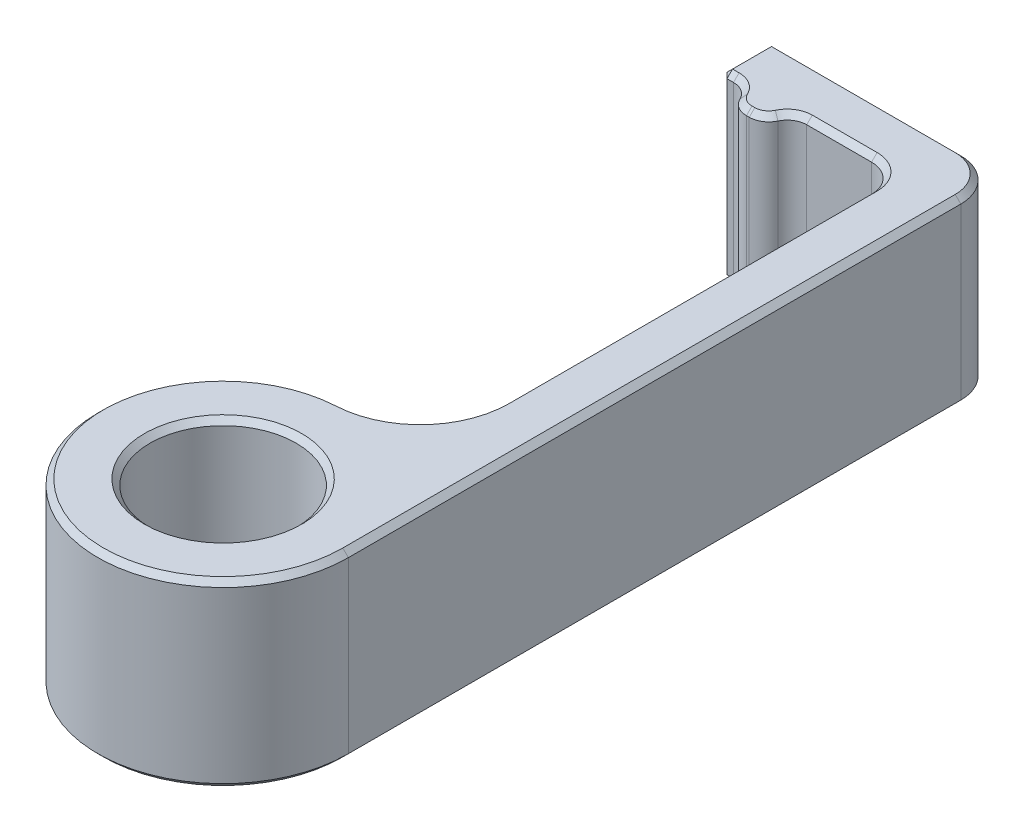
from build123d import *

# Parameters (mm, degrees)
SKETCH_1_R      = 5.25
EXTRUDE_1_DEPTH = 13
FILLET_1_R      = 6
FILLET_2_R      = 2
FILLET_3_R      = 3
SKETCH_2_W      = 3
SKETCH_2_H      = 13
EXTRUDE_2_DEPTH = 1.6
FILLET_4_R      = 1.4
FILLET_5_R      = 1.4
CHAMFER_1_SIZE  = 0.4


with BuildPart() as part:
    # 草图1 → 凸台-拉伸1 (new body)
    with BuildSketch(Plane(origin=(0, 0, 0), x_dir=(1, 0, 0), z_dir=(0, 1, 0))):
        with BuildLine():
            Line((5.188235294, 7.354061091), (5.188235294, 43.4))
            Line((5.188235294, 43.4), (-7.6, 43.4))
            Line((-7.6, 43.4), (-7.6, 47))
            Line((-7.6, 47), (5.4, 47))
            Line((5.4, 47), (9, 47))
            Line((9, 47), (9, 0))
            ThreePointArc((9, 0), (-7.990435459, -4.14161094), (5.188235294, 7.354061091))
        make_face()
        with Locations(Location((0, 0, 0), (0, 0, 90))):
            Circle(SKETCH_1_R, mode=Mode.SUBTRACT)
    extrude(amount=EXTRUDE_1_DEPTH)

    # 圆角1
    fillet_1_edges = [part.edges().sort_by_distance(p)[0] for p in [
        (5.188235294, 6.5, -7.354061091),
    ]]
    fillet(fillet_1_edges, radius=FILLET_1_R)

    # 圆角2
    fillet_2_edges = [part.edges().sort_by_distance(p)[0] for p in [
        (5.188235294, 6.5, -43.4),
    ]]
    fillet(fillet_2_edges, radius=FILLET_2_R)

    # 圆角3
    fillet_3_edges = [part.edges().sort_by_distance(p)[0] for p in [
        (9, 6.5, -47),
    ]]
    fillet(fillet_3_edges, radius=FILLET_3_R)

    # 草图2 → 凸台-拉伸2 (add)
    with BuildSketch(Plane.XY.offset(-43.4)):
        with Locations((-4.1, 6.5)):
            Rectangle(SKETCH_2_W, SKETCH_2_H)
    extrude(amount=EXTRUDE_2_DEPTH)

    # 圆角4
    fillet_4_edges = [part.edges().sort_by_distance(p)[0] for p in [
        (-5.6, 6.5, -41.8),
        (-2.6, 6.5, -41.8),
    ]]
    fillet(fillet_4_edges, radius=FILLET_4_R)

    # 圆角5
    fillet_5_edges = [part.edges().sort_by_distance(p)[0] for p in [
        (-2.6, 6.5, -43.4),
        (-5.6, 6.5, -43.4),
    ]]
    fillet(fillet_5_edges, radius=FILLET_5_R)

    # 倒角1
    chamfer_1_edges = [part.edges().sort_by_distance(p)[0] for p in [
        (-7.6, 6.5, -43.4),
        (-7.6, 6.5, -47),
        (0, 0, 5.25),
        (0, 13, 5.25),
        (-7.6, 13, -45.2),
        (-7.164911064, 13, -43.4),
        (-6.189364692, 0, 6.533893533),
        (-6.189364692, 13, 6.533893533),
        (3.544164316, 0, -10.851775368),
        (3.544164316, 13, -10.851775368),
        (5.188235294, 0, -28.189009248),
        (5.188235294, 13, -28.189009248),
        (4.602448856, 0, -42.814213562),
        (4.602448856, 13, -42.814213562),
        (-0.8, 0, -47),
        (-0.8, 13, -47),
        (8.121320344, 0, -46.121320344),
        (8.121320344, 13, -46.121320344),
        (-4.1, 0, -41.8),
        (-4.1, 13, -41.8),
        (-3.251668523, 13, -42.016784043),
        (-4.948331477, 0, -42.016784043),
        (-3.251668523, 0, -42.016784043),
        (0.859028711, 0, -43.4),
        (0.859028711, 13, -43.4),
        (-4.948331477, 13, -42.016784043),
        (-2.218509349, 13, -43.183215957),
        (-2.218509349, 0, -43.183215957),
        (-5.981490651, 0, -43.183215957),
        (-5.981490651, 13, -43.183215957),
        (-7.164911064, 0, -43.4),
        (-7.6, 0, -45.2),
        (9, 13, -22),
        (9, 0, -22),
    ]]
    chamfer(chamfer_1_edges, length=CHAMFER_1_SIZE)


solid = part.part
